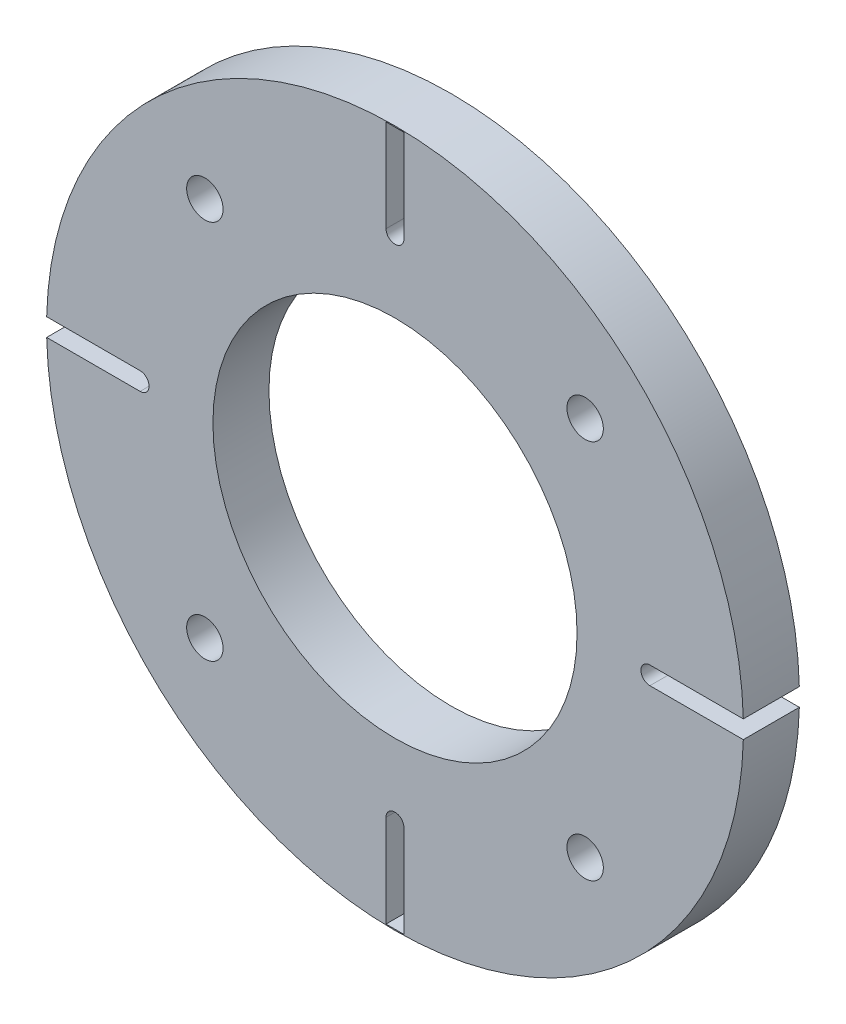
from build123d import *

# Parameters (mm, degrees)
IZIM1_R                     = 62.2
Y_KSEKLIK_EKSTR_ZYON1_DEPTH = 10
IZIM2_R                     = 32.5
KES_EKSTR_ZYON1_DEPTH       = 10
KES_EKSTR_ZYON2_DEPTH       = 10
IZIM5_R                     = 3.25
KES_EKSTR_ZYON3_DEPTH       = 10


with BuildPart() as part:
    # Çizim1 → Yükseklik-Ekstrüzyon1 (new body)
    with BuildSketch(Plane.XY):
        Circle(IZIM1_R)
    extrude(amount=Y_KSEKLIK_EKSTR_ZYON1_DEPTH)

    # Çizim2 → Kes-Ekstrüzyon1 (cut)
    with BuildSketch(Plane.XY.offset(10)):
        Circle(IZIM2_R)
    extrude(amount=-KES_EKSTR_ZYON1_DEPTH, mode=Mode.SUBTRACT)

    # Çizim4 → Kes-Ekstrüzyon2 (cut)
    with BuildSketch(Plane.XY.offset(10)):
        with BuildLine():
            Line((1.6, -62), (1.6, -45.5))
            ThreePointArc((1.6, -45.5), (0, -43.9), (-1.6, -45.5))
            Line((-1.6, -45.5), (-1.6, -62))
            Line((-1.6, -62), (1.6, -62))
        make_face()
        with BuildLine():
            Line((-1.6, 62), (-1.6, 45.5))
            ThreePointArc((-1.6, 45.5), (0, 43.9), (1.6, 45.5))
            Line((1.6, 45.5), (1.6, 62))
            Line((1.6, 62), (-1.6, 62))
        make_face()
        with BuildLine():
            Line((62.2, 1.6), (62.2, -1.6))
            Line((62.2, -1.6), (45.5, -1.6))
            ThreePointArc((45.5, -1.6), (43.9, 0), (45.5, 1.6))
            Line((45.5, 1.6), (62.2, 1.6))
        make_face()
        with BuildLine():
            Line((-62.2, -1.6), (-45.5, -1.6))
            ThreePointArc((-45.5, -1.6), (-43.9, 0), (-45.5, 1.6))
            Line((-45.5, 1.6), (-62.2, 1.6))
            Line((-62.2, 1.6), (-62.2, -1.6))
        make_face()
    extrude(amount=-KES_EKSTR_ZYON2_DEPTH, mode=Mode.SUBTRACT)

    # Çizim5 → Kes-Ekstrüzyon3 (cut)
    with BuildSketch(Plane(origin=(0, 0, 0), x_dir=(-1, 0, 0), z_dir=(0, 0, -1))):
        with Locations((-33.941125497, 33.941125497)):
            Circle(IZIM5_R)
        with Locations((33.941125497, 33.941125497)):
            Circle(IZIM5_R)
        with Locations((33.941125497, -33.941125497)):
            Circle(IZIM5_R)
        with Locations((-33.941125497, -33.941125497)):
            Circle(IZIM5_R)
    extrude(amount=-KES_EKSTR_ZYON3_DEPTH, mode=Mode.SUBTRACT)


solid = part.part
